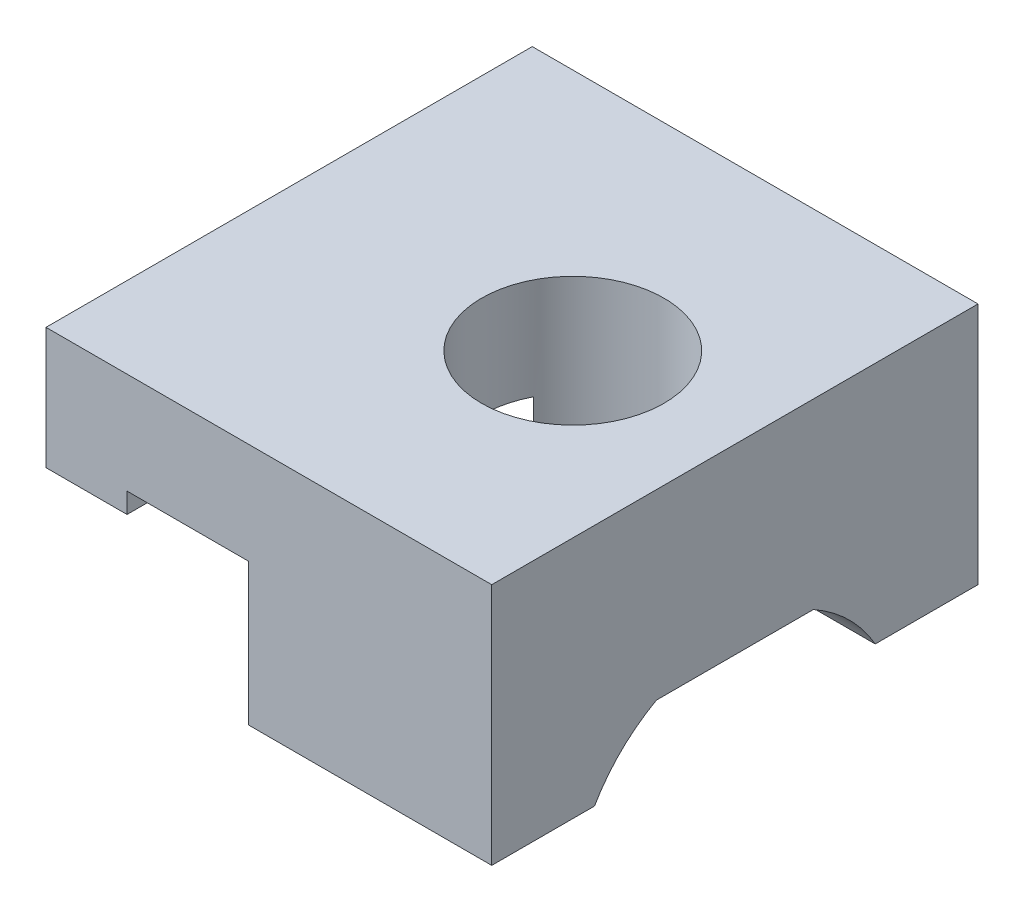
from build123d import *

# Parameters (mm, degrees)
BOSS_EXTRUDE1_DEPTH      = 4
BOSS_EXTRUDE1_DEPTH_BACK = 7
CUT_EXTRUDE1_DEPTH       = 12
CUT_EXTRUDE1_DEPTH_BACK  = 12
SKETCH3_R                = 2.25
CUT_EXTRUDE2_DEPTH       = 12


with BuildPart() as part:
    # Sketch1 → Boss-Extrude1 (new, two sides: drawn at the far end of the back side and taken through both)
    with BuildSketch(Plane(origin=(0, 0, 0), x_dir=(0, 0, -1), z_dir=(1, 0, 0)).offset(-BOSS_EXTRUDE1_DEPTH_BACK)):
        with BuildLine():
            Line((6, -6), (6, 0))
            Line((6, 0), (-6, 0))
            Line((-6, 0), (-6, -6))
            Line((-6, -6), (-3.464101615, -6))
            ThreePointArc((-3.464101615, -6), (-2.802517077, -5.145898034), (-1.936491673, -4.5))
            Line((-1.936491673, -4.5), (1.936491673, -4.5))
            ThreePointArc((1.936491673, -4.5), (2.802517077, -5.145898034), (3.464101615, -6))
            Line((3.464101615, -6), (6, -6))
        make_face()
    extrude(amount=BOSS_EXTRUDE1_DEPTH + BOSS_EXTRUDE1_DEPTH_BACK)

    # Sketch2 → Cut-Extrude1 (cut, two sides: drawn at the far end of the back side and taken through both)
    with BuildSketch(Plane.XY.offset(-CUT_EXTRUDE1_DEPTH_BACK)):
        Polygon((-7, -3), (-5, -3), (-5, -2.5), (-2, -2.5), (-2, -6), (-7, -6), align=None)
    extrude(amount=CUT_EXTRUDE1_DEPTH + CUT_EXTRUDE1_DEPTH_BACK, mode=Mode.SUBTRACT)

    # Sketch3 → Cut-Extrude2 (cut, through all)
    with BuildSketch(Plane(origin=(0, 0, 0), x_dir=(1, 0, 0), z_dir=(0, 1, 0))):
        with Locations(Location((0, 0, 0), (0, 0, 270))):
            Circle(SKETCH3_R)
    extrude(amount=-CUT_EXTRUDE2_DEPTH, mode=Mode.SUBTRACT)


solid = part.part
